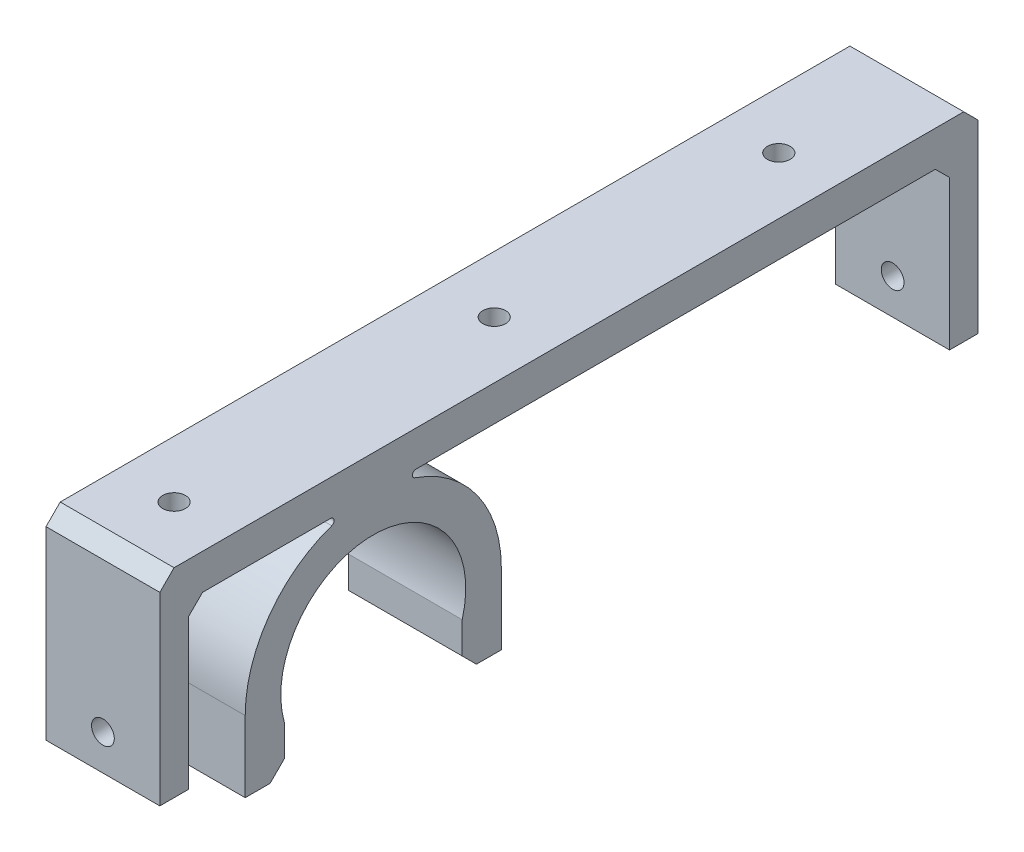
from build123d import *

# Parameters (mm, degrees)
BOSS_EXTRUDE1_DEPTH = 8
CHAMFER1_SIZE       = 2
CHAMFER2_SIZE       = 2
CUT_EXTRUDE1_REACH  = 119.55
SKETCH2_R           = 1.6
CUT_EXTRUDE2_REACH  = 119.55
SKETCH3_R           = 1.6
CUT_EXTRUDE3_REACH  = 93.531
SKETCH4_R           = 1.6


with BuildPart() as part:
    # Sketch1 → Boss-Extrude1 (new, symmetric)
    with BuildSketch(Plane(origin=(0, 0, 0), x_dir=(0, 0, -1), z_dir=(1, 0, 0))):
        with BuildLine():
            Line((-12.5, -3.570714214), (-12.5, -10))
            Line((-12.5, -10), (-18, -10))
            Line((-18, -10), (-18, 0))
            ThreePointArc((-18, 0), (-14.647202482, 10.462287487), (-5.837837838, 17.027027027))
            ThreePointArc((-5.837837838, 17.027027027), (-5.506803038, 17.582199494), (-6, 18))
            Line((-6, 18), (-26, 18))
            Line((-26, 18), (-26, -5))
            Line((-26, -5), (-30, -5))
            Line((-30, -5), (-30, 18))
            Line((-30, 18), (-30, 23))
            Line((-30, 23), (85, 23))
            Line((85, 23), (85, 18))
            Line((85, 18), (85, -5))
            Line((85, -5), (81, -5))
            Line((81, -5), (81, 18))
            Line((81, 18), (6, 18))
            ThreePointArc((6, 18), (5.506803038, 17.582199494), (5.837837838, 17.027027027))
            ThreePointArc((5.837837838, 17.027027027), (14.647202482, 10.462287487), (18, 0))
            Line((18, 0), (18, -10))
            Line((18, -10), (12.5, -10))
            Line((12.5, -10), (12.5, -3.570714214))
            ThreePointArc((12.5, -3.570714214), (0, 13), (-12.5, -3.570714214))
        make_face()
    extrude(amount=BOSS_EXTRUDE1_DEPTH, both=True)

    # Chamfer1
    chamfer1_edges = [part.edges().sort_by_distance(p)[0] for p in [
        (0, 18, 26),
        (0, 18, -81),
    ]]
    chamfer(chamfer1_edges, length=CHAMFER1_SIZE)

    # Chamfer2
    chamfer2_edges = [part.edges().sort_by_distance(p)[0] for p in [
        (0, -10, -12.5),
        (0, -10, 12.5),
        (0, 23, 30),
        (0, 23, -85),
    ]]
    chamfer(chamfer2_edges, length=CHAMFER2_SIZE)

    # Sketch2 → Cut-Extrude1 (cut, up to next)
    with BuildSketch(Plane.XY.offset(30), mode=Mode.PRIVATE) as cut_extrude1_sk1:
        Circle(SKETCH2_R)
    cut_extrude1_tool1 = extrude(cut_extrude1_sk1.sketch, amount=-CUT_EXTRUDE1_REACH, mode=Mode.PRIVATE) & part.part
    add(cut_extrude1_tool1.solids().sort_by_distance((0, 0, 30))[0], mode=Mode.SUBTRACT)

    # Sketch3 → Cut-Extrude2 (cut, up to next)
    with BuildSketch(Plane(origin=(0, 0, -85), x_dir=(-1, 0, 0), z_dir=(0, 0, -1)), mode=Mode.PRIVATE) as cut_extrude2_sk1:
        with Locations(Location((0, 0, 0), (0, 0, 180))):
            Circle(SKETCH3_R)
    cut_extrude2_tool1 = extrude(cut_extrude2_sk1.sketch, amount=-CUT_EXTRUDE2_REACH, mode=Mode.PRIVATE) & part.part
    add(cut_extrude2_tool1.solids().sort_by_distance((0, 0, -85))[0], mode=Mode.SUBTRACT)

    # Sketch4 → Cut-Extrude3 (cut, up to next)
    with BuildSketch(Plane(origin=(0, 23, 0), x_dir=(1, 0, 0), z_dir=(0, 1, 0)), mode=Mode.PRIVATE) as cut_extrude3_sk1:
        with Locations(Location((0, 65, 0), (0, 0, 270))):
            Circle(SKETCH4_R)
    cut_extrude3_tool1 = extrude(cut_extrude3_sk1.sketch, amount=-CUT_EXTRUDE3_REACH, mode=Mode.PRIVATE) & part.part
    # Sketch4 → Cut-Extrude3 (cut, up to next)
    with BuildSketch(Plane(origin=(0, 23, 0), x_dir=(1, 0, 0), z_dir=(0, 1, 0)), mode=Mode.PRIVATE) as cut_extrude3_sk2:
        with Locations(Location((0, 25, 0), (0, 0, 270))):
            Circle(SKETCH4_R)
    cut_extrude3_tool2 = extrude(cut_extrude3_sk2.sketch, amount=-CUT_EXTRUDE3_REACH, mode=Mode.PRIVATE) & part.part
    # Sketch4 → Cut-Extrude3 (cut, up to next)
    with BuildSketch(Plane(origin=(0, 23, 0), x_dir=(1, 0, 0), z_dir=(0, 1, 0)), mode=Mode.PRIVATE) as cut_extrude3_sk3:
        with Locations(Location((0, -20, 0), (0, 0, 270))):
            Circle(SKETCH4_R)
    cut_extrude3_tool3 = extrude(cut_extrude3_sk3.sketch, amount=-CUT_EXTRUDE3_REACH, mode=Mode.PRIVATE) & part.part
    add(cut_extrude3_tool1.solids().sort_by_distance((0, 23, -65))[0], mode=Mode.SUBTRACT)
    add(cut_extrude3_tool2.solids().sort_by_distance((0, 23, -25))[0], mode=Mode.SUBTRACT)
    add(cut_extrude3_tool3.solids().sort_by_distance((0, 23, 20))[0], mode=Mode.SUBTRACT)


solid = part.part
